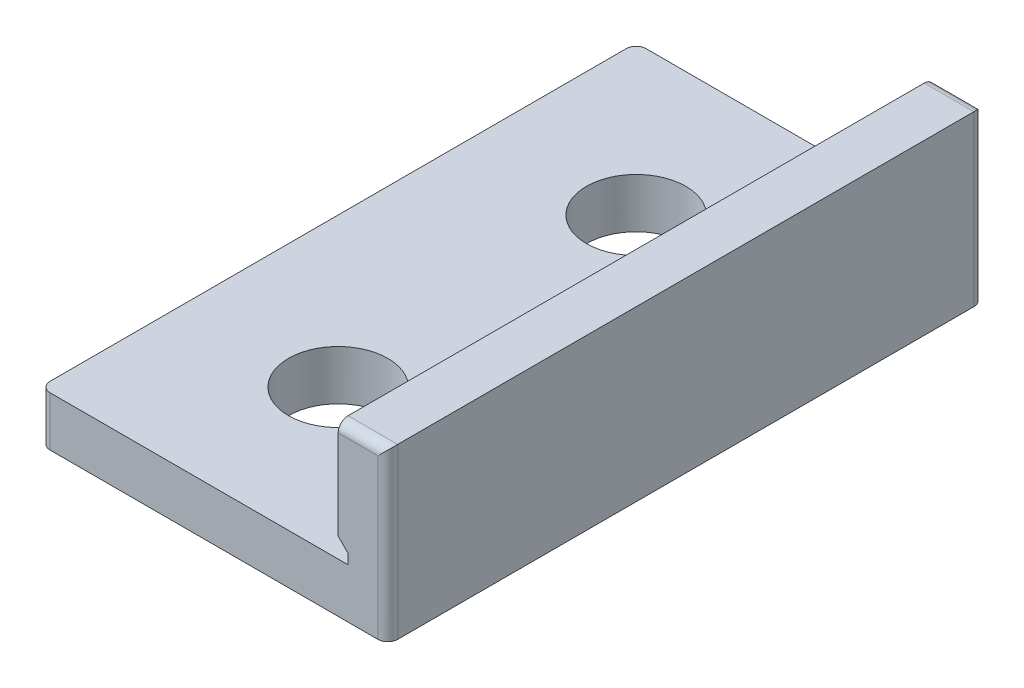
from build123d import *

# Parameters (mm, degrees)
EXTRUDE_THIN1_DEPTH  = 30
M8_CLEARANCE_HOLE1_D = 10
CUT_EXTRUDE1_REACH   = 72.491
FILLET1_R            = 1


with BuildPart() as part:
    # Sketch1 → Extrude-Thin1 (new, symmetric)
    with BuildSketch(Plane.XY):
        Polygon((0, 0), (30, 0), (30, 12), (35, 12), (35, -5), (0, -5), align=None)
    extrude(amount=EXTRUDE_THIN1_DEPTH, both=True)

    # M8 Clearance Hole1 (through all)
    with Locations(Plane(origin=(0, -5, 0), x_dir=(-1, 0, 0), z_dir=(0, -1, 0))):
        with Locations((-15, 15), (-15, -15)):
            Hole(M8_CLEARANCE_HOLE1_D / 2)

    # Sketch5 → Cut-Extrude1 (cut, up to next)
    with BuildSketch(Plane(origin=(0, 0, -30), x_dir=(-1, 0, 0), z_dir=(0, 0, -1)), mode=Mode.PRIVATE) as cut_extrude1_sk1:
        Polygon((-30, 0), (-31, 0), (-31, 1), (-30, 2), align=None)
    cut_extrude1_tool1 = extrude(cut_extrude1_sk1.sketch, amount=-CUT_EXTRUDE1_REACH, mode=Mode.PRIVATE) & part.part
    add(cut_extrude1_tool1.solids().sort_by_distance((30.444444, 0.777778, -30))[0], mode=Mode.SUBTRACT)

    # Fillet1
    fillet1_edges = [part.edges().sort_by_distance(p)[0] for p in [
        (0, -2.5, 30),
        (35, 3.5, 30),
        (0, -2.5, -30),
        (32.5, 12, -30),
        (35, 3.5, -30),
        (32.5, 12, 30),
    ]]
    fillet(fillet1_edges, radius=FILLET1_R)


solid = part.part
